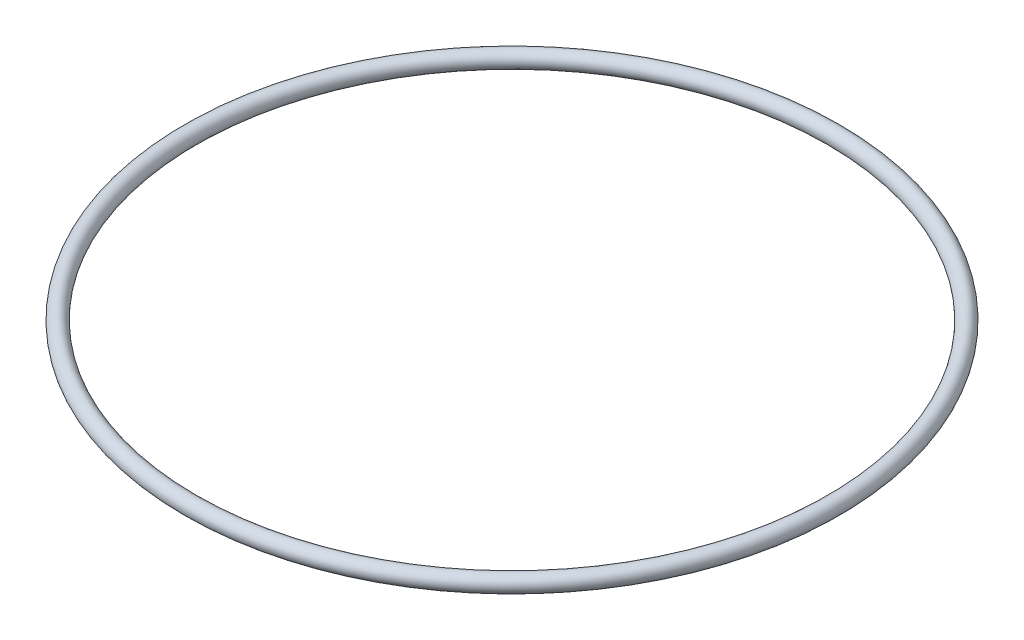
from build123d import *

# Parameters (mm, degrees)
RECONSTRUCTED_NOMINAL_AXIAL_PROFILE_R = 1


with BuildPart() as part:
    # Reconstructed nominal axial profile → Native revolved geometry (revolve)
    with BuildSketch(Plane.XY, mode=Mode.PRIVATE) as native_revolved_geometry_sk:
        with Locations((39, 0)):
            Circle(RECONSTRUCTED_NOMINAL_AXIAL_PROFILE_R)
    revolve(native_revolved_geometry_sk.sketch.rotate(Axis((0, -500, 0), (0, 1, 0)), 90), axis=Axis((0, -500, 0), (0, 1, 0)))


solid = part.part
